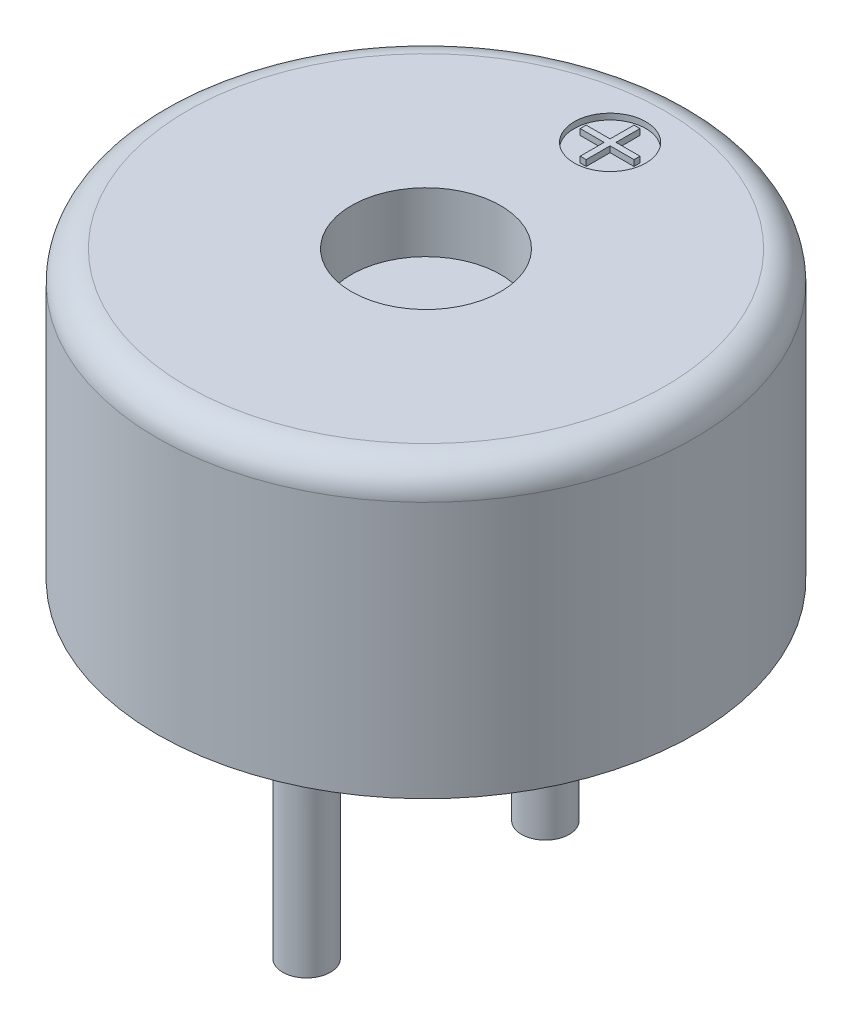
from build123d import *

# Parameters (mm, degrees)
SKETCH1_R          = 4.5
EXTRUDE1_DEPTH     = 4.8
FILLET1_R          = 0.5
SKETCH6_R          = 0.4
EXTRUDE6_DEPTH     = 4.5
SKETCH2_R          = 1.25
CUT_EXTRUDE2_DEPTH = 1
SKETCH8_R          = 0.6
CUT_EXTRUDE3_DEPTH = 0.1


with BuildPart() as part:
    # Sketch1 → Extrude1 (new body)
    with BuildSketch(Plane(origin=(0, 0, 0), x_dir=(1, 0, 0), z_dir=(0, 1, 0))):
        with Locations(Location((0, 0, 0), (0, 0, 270))):
            Circle(SKETCH1_R)
    extrude(amount=EXTRUDE1_DEPTH)

    # Fillet1
    fillet1_edges = [part.edges().sort_by_distance(p)[0] for p in [
        (0, 4.8, -4.5),
    ]]
    fillet(fillet1_edges, radius=FILLET1_R)

    # Sketch6 → Extrude6 (add)
    with BuildSketch(Plane.XZ):
        with Locations(Location((0, -2, 0), (0, 0, 90))):
            Circle(SKETCH6_R)
        with Locations(Location((0, 2, 0), (0, 0, 90))):
            Circle(SKETCH6_R)
    extrude(amount=EXTRUDE6_DEPTH)

    # Sketch2 → Cut-Extrude2 (cut)
    with BuildSketch(Plane(origin=(0, 4.8, 0), x_dir=(1, 0, 0), z_dir=(0, 1, 0))):
        with Locations(Location((0, 0, 0), (0, 0, 270))):
            Circle(SKETCH2_R)
    extrude(amount=-CUT_EXTRUDE2_DEPTH, mode=Mode.SUBTRACT)

    # Sketch8 → Cut-Extrude3 (cut)
    with BuildSketch(Plane(origin=(0, 4.8, 0), x_dir=(1, 0, 0), z_dir=(0, 1, 0))):
        with Locations(Location((0, 3.083775569, 0), (0, 0, 270))):
            Circle(SKETCH8_R)
        Polygon((0.05, 3.533775569), (-0.05, 3.533775569), (-0.05, 3.133775569), (-0.45, 3.133775569), (-0.45, 3.033775569), (-0.05, 3.033775569), (-0.05, 2.633775569), (0.05, 2.633775569), (0.05, 3.033775569), (0.45, 3.033775569), (0.45, 3.133775569), (0.05, 3.133775569), align=None, mode=Mode.SUBTRACT)
    extrude(amount=-CUT_EXTRUDE3_DEPTH, mode=Mode.SUBTRACT)


solid = part.part
